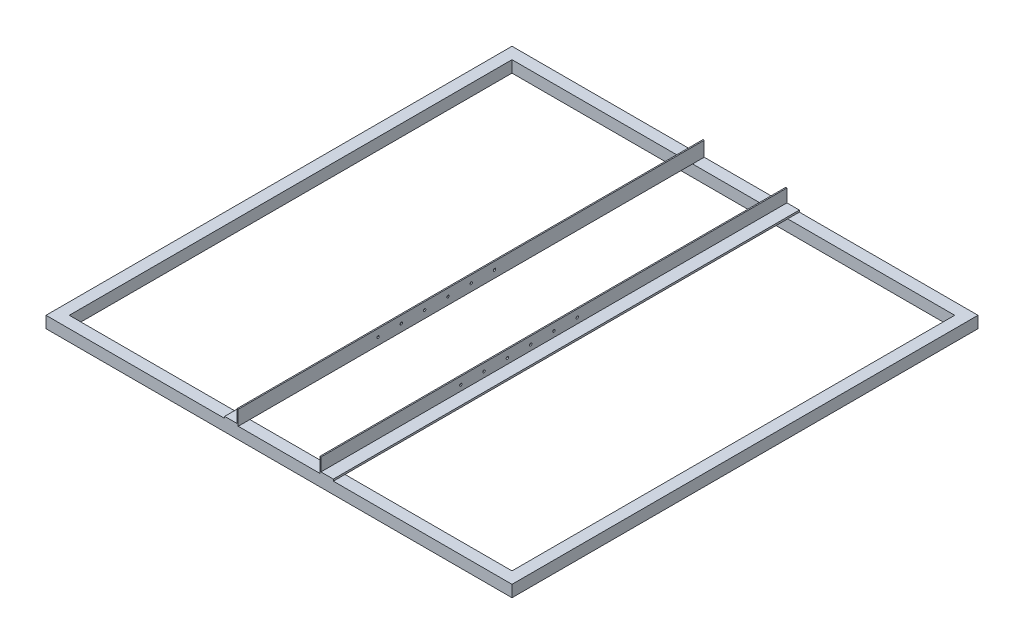
from build123d import *

# Parameters (mm, degrees)
SKETCH1_W           = 800
SKETCH1_H           = 800
SKETCH1_W_2         = 760
SKETCH1_H_2         = 760
BOSS_EXTRUDE1_DEPTH = 20
SKETCH2_W           = 2
SKETCH2_H           = 800
BOSS_EXTRUDE2_DEPTH = 25.3
SKETCH3_R           = 2.1
CUT_EXTRUDE2_DEPTH  = 158
SKETCH4_W           = 21.3
SKETCH4_H           = 800
BOSS_EXTRUDE3_DEPTH = 3.09


with BuildPart() as part:
    # Sketch1 → Boss-Extrude1 (new body)
    with BuildSketch(Plane(origin=(0, 0, 0), x_dir=(1, 0, 0), z_dir=(0, 1, 0))):
        Rectangle(SKETCH1_W, SKETCH1_H)
        Rectangle(SKETCH1_W_2, SKETCH1_H_2, mode=Mode.SUBTRACT)
    extrude(amount=BOSS_EXTRUDE1_DEPTH)

    # Sketch2 → Boss-Extrude2 (add)
    with BuildSketch(Plane(origin=(0, 20, 0), x_dir=(1, 0, 0), z_dir=(0, 1, 0))):
        with Locations((-71, 0)):
            Rectangle(SKETCH2_W, SKETCH2_H)
        with Locations((71, 0)):
            Rectangle(SKETCH2_W, SKETCH2_H)
    extrude(amount=BOSS_EXTRUDE2_DEPTH)

    # Sketch3 → Cut-Extrude2 (cut)
    with BuildSketch(Plane.ZY.offset(72)):
        with Locations((0, 32.65)):
            Circle(SKETCH3_R)
        with Locations((-40, 32.65)):
            Circle(SKETCH3_R)
        with Locations((40, 32.65)):
            Circle(SKETCH3_R)
        with Locations((80, 32.65)):
            Circle(SKETCH3_R)
        with Locations((120, 32.65)):
            Circle(SKETCH3_R)
        with Locations((160, 32.65)):
            Circle(SKETCH3_R)
    extrude(amount=-CUT_EXTRUDE2_DEPTH, mode=Mode.SUBTRACT)

    # Sketch4 → Boss-Extrude3 (add)
    with BuildSketch(Plane(origin=(0, 20, 0), x_dir=(1, 0, 0), z_dir=(0, 1, 0))):
        with Locations((82.65, 0)):
            Rectangle(SKETCH4_W, SKETCH4_H)
        with Locations((-82.65, 0)):
            Rectangle(SKETCH4_W, SKETCH4_H)
    extrude(amount=BOSS_EXTRUDE3_DEPTH)


solid = part.part
